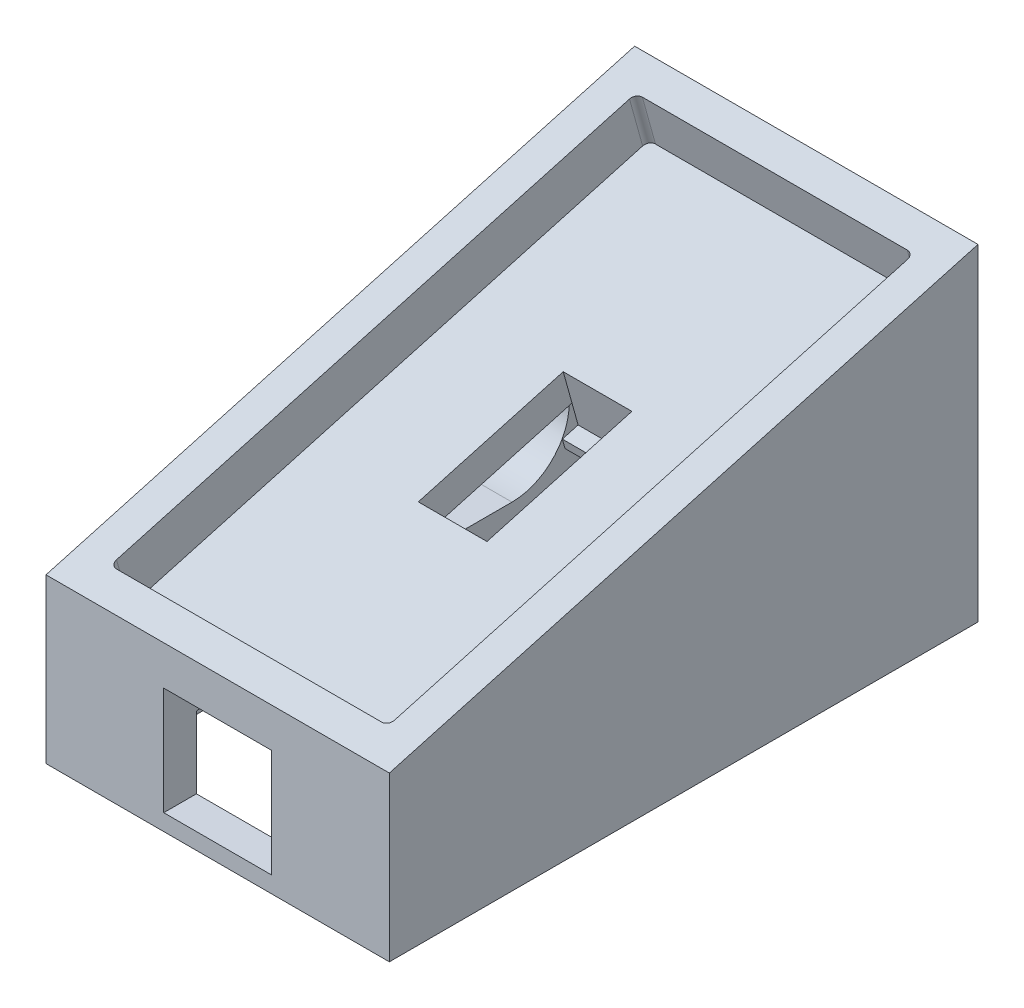
from build123d import *

# Parameters (mm, degrees)
SKETCH2_W            = 300
SKETCH2_H            = 180
BOSS_EXTRUDE1_DEPTH  = 50
CUT_EXTRUDE1_DEPTH   = 15
BOSS_EXTRUDE4_DEPTH  = 50
SKETCH10_W           = 105
SKETCH10_H           = 180
BOSS_EXTRUDE7_DEPTH  = 50
CUT_EXTRUDE3_DEPTH   = 105
CUT_EXTRUDE4_DEPTH   = 15
SKETCH14_W           = 70
SKETCH14_H           = 65
SKETCH14_W_2         = 95
BOSS_EXTRUDE8_DEPTH  = 35
CUT_EXTRUDE5_DEPTH   = 195
SHELL1_T             = -10
SKETCH16_W           = 21
SKETCH16_H           = 46
CUT_EXTRUDE7_DEPTH   = 10
SKETCH17_R           = 17.5
CUT_EXTRUDE15_DEPTH  = 10
CUT_EXTRUDE16_DEPTH  = 10
SKETCH22_W           = 40.092518347
SKETCH22_H           = 11.168807906
CUT_EXTRUDE17_DEPTH  = 33
SKETCH23_W           = 21
SKETCH23_H           = 10
BOSS_EXTRUDE9_DEPTH  = 3
SKETCH24_W           = 21
SKETCH24_H           = 3
BOSS_EXTRUDE10_DEPTH = 5
CUT_EXTRUDE18_DEPTH  = 10
SKETCH27_W           = 26
SKETCH27_H           = 30
CUT_EXTRUDE19_DEPTH  = 10


with BuildPart() as part:
    # Sketch2 → Boss-Extrude1 (new body)
    with BuildSketch(Plane(origin=(0, 0, 0), x_dir=(1, 0, 0), z_dir=(0, 1, 0))):
        with Locations((150, 90)):
            Rectangle(SKETCH2_W, SKETCH2_H)
    extrude(amount=BOSS_EXTRUDE1_DEPTH)

    # Sketch3 → Cut-Extrude1 (cut)
    with BuildSketch(Plane(origin=(0, 50, 0), x_dir=(1, 0, 0), z_dir=(0, 1, 0))):
        with BuildLine():
            Line((90, 12), (90, 73))
            ThreePointArc((90, 73), (90.585786438, 74.414213562), (92, 75))
            Line((92, 75), (183, 75))
            ThreePointArc((183, 75), (184.414213562, 74.414213562), (185, 73))
            Line((185, 73), (185, 12))
            ThreePointArc((185, 12), (184.414213562, 10.585786438), (183, 10))
            Line((183, 10), (92, 10))
            ThreePointArc((92, 10), (90.585786438, 10.585786438), (90, 12))
        make_face()
        with BuildLine():
            Line((12, 10), (78, 10))
            ThreePointArc((78, 10), (79.414213562, 10.585786438), (80, 12))
            Line((80, 12), (80, 73))
            ThreePointArc((80, 73), (79.414213562, 74.414213562), (78, 75))
            Line((78, 75), (12, 75))
            ThreePointArc((12, 75), (10.585786438, 74.414213562), (10, 73))
            Line((10, 73), (10, 12))
            ThreePointArc((10, 12), (10.585786438, 10.585786438), (12, 10))
        make_face()
    extrude(amount=-CUT_EXTRUDE1_DEPTH, mode=Mode.SUBTRACT)

    # Sketch6 → Boss-Extrude4 (add)
    with BuildSketch(Plane(origin=(0, 50, 0), x_dir=(1, 0, 0), z_dir=(0, 1, 0))):
        Polygon((0, 180), (185, 180), (195, 180), (195, 95), (185, 95), (0, 95), align=None)
        with BuildLine():
            Line((185, 168), (185, 107))
            ThreePointArc((185, 107), (184.414213562, 105.585786438), (183, 105))
            Line((183, 105), (92, 105))
            ThreePointArc((92, 105), (90.585786438, 105.585786438), (90, 107))
            Line((90, 107), (90, 168))
            ThreePointArc((90, 168), (90.585786438, 169.414213562), (92, 170))
            Line((92, 170), (183, 170))
            ThreePointArc((183, 170), (184.414213562, 169.414213562), (185, 168))
        make_face(mode=Mode.SUBTRACT)
        with BuildLine():
            Line((80, 107), (80, 168))
            ThreePointArc((80, 168), (79.414213562, 169.414213562), (78, 170))
            Line((78, 170), (12, 170))
            ThreePointArc((12, 170), (10.585786438, 169.414213562), (10, 168))
            Line((10, 168), (10, 107))
            ThreePointArc((10, 107), (10.585786438, 105.585786438), (12, 105))
            Line((12, 105), (78, 105))
            ThreePointArc((78, 105), (79.414213562, 105.585786438), (80, 107))
        make_face(mode=Mode.SUBTRACT)
    extrude(amount=BOSS_EXTRUDE4_DEPTH)

    # Sketch10 → Boss-Extrude7 (add)
    with BuildSketch(Plane(origin=(0, 50, 0), x_dir=(1, 0, 0), z_dir=(0, 1, 0))):
        with Locations((247.5, 90)):
            Rectangle(SKETCH10_W, SKETCH10_H)
    extrude(amount=BOSS_EXTRUDE7_DEPTH)

    # Sketch11 → Cut-Extrude3 (cut)
    with BuildSketch(Plane(origin=(300, 0, 0), x_dir=(0, 0, -1), z_dir=(1, 0, 0))):
        Polygon((0, 100), (180, 100), (0, 50), align=None)
    extrude(amount=-CUT_EXTRUDE3_DEPTH, mode=Mode.SUBTRACT)

    # Sketch13 → Cut-Extrude4 (cut)
    with BuildSketch(Plane(origin=(0, 46.418338109, 12.893982808), x_dir=(1, 0, 0), z_dir=(0, 0.9635179096299407, 0.2676438637860946))):
        with BuildLine():
            Line((288, 190.197610112), (207, 190.197610112))
            ThreePointArc((207, 190.197610112), (205.585786438, 189.611823674), (205, 188.197610112))
            Line((205, 188.197610112), (205, 25.382193189))
            ThreePointArc((205, 25.382193189), (205.585786438, 23.967979627), (207, 23.382193189))
            Line((207, 23.382193189), (288, 23.382193189))
            ThreePointArc((288, 23.382193189), (289.414213562, 23.967979627), (290, 25.382193189))
            Line((290, 25.382193189), (290, 188.197610112))
            ThreePointArc((290, 188.197610112), (289.414213562, 189.611823674), (288, 190.197610112))
        make_face()
    extrude(amount=-CUT_EXTRUDE4_DEPTH, mode=Mode.SUBTRACT)

    # Sketch14 → Boss-Extrude8 (add)
    with BuildSketch(Plane(origin=(0, 50, 0), x_dir=(1, 0, 0), z_dir=(0, 1, 0))):
        with Locations((45, 137.5)):
            Rectangle(SKETCH14_W, SKETCH14_H)
        with Locations((137.5, 137.5)):
            Rectangle(SKETCH14_W_2, SKETCH14_H)
    extrude(amount=BOSS_EXTRUDE8_DEPTH)

    # Sketch15 → Cut-Extrude5 (cut)
    with BuildSketch(Plane.ZY):
        Polygon((-180, 0), (0, 0), (0, 50), (-95, 50), (-95, 100), (-180, 100), align=None)
    extrude(amount=-CUT_EXTRUDE5_DEPTH, mode=Mode.SUBTRACT)

    # Shell1
    shell1_openings = [part.faces().sort_by_distance(p)[0] for p in [
        (247.5, 0, -90),
    ]]
    offset(amount=SHELL1_T, openings=shell1_openings, kind=Kind.INTERSECTION)

    # Sketch16 → Cut-Extrude7 (cut)
    with BuildSketch(Plane(origin=(0, 31.965569464, 8.879324851), x_dir=(1, 0, 0), z_dir=(0, 0.9635179096299407, 0.2676438637860946))):
        with Locations((247.5, 106.782193189)):
            Rectangle(SKETCH16_W, SKETCH16_H)
    extrude(amount=-CUT_EXTRUDE7_DEPTH, mode=Mode.SUBTRACT)

    # Sketch17 → Cut-Extrude15 (cut)
    with BuildSketch(Plane.ZY.offset(-195)):
        with Locations((-132.5, 25.5)):
            Circle(SKETCH17_R)
        with Locations((-47.5, 25.5)):
            Circle(SKETCH17_R)
    extrude(amount=-CUT_EXTRUDE15_DEPTH, mode=Mode.SUBTRACT)

    # Sketch20 → Cut-Extrude16 (cut)
    with BuildSketch(Plane.XY):
        Polygon((264, 38), (245, 38), (237, 38), (231, 38), (231, 34), (231, 25), (231, 5), (264, 5), align=None)
    extrude(amount=-CUT_EXTRUDE16_DEPTH, mode=Mode.SUBTRACT)

    # Sketch22 → Cut-Extrude17 (cut)
    with BuildSketch(Plane.ZY.offset(-264)):
        with Locations((-30.046259174, 32.415596047)):
            Rectangle(SKETCH22_W, SKETCH22_H)
    extrude(amount=CUT_EXTRUDE17_DEPTH, mode=Mode.SUBTRACT)

    # Sketch23 → Boss-Extrude9 (add)
    with BuildSketch(Plane(origin=(0, 34.735407636, -125.047467489), x_dir=(1, 0, 0), z_dir=(0, -0.2676438637860946, 0.9635179096299407))):
        with Locations((247.5, 18.175895481)):
            Rectangle(SKETCH23_W, SKETCH23_H)
    boss_extrude9 = extrude(amount=-BOSS_EXTRUDE9_DEPTH)

    # Sketch24 → Boss-Extrude10 (add)
    with BuildSketch(Plane(origin=(0, 34.735407636, -125.047467489), x_dir=(1, 0, 0), z_dir=(0, -0.2676438637860946, 0.9635179096299407))):
        with Locations((247.5, 14.675895481)):
            Rectangle(SKETCH24_W, SKETCH24_H)
    boss_extrude10 = extrude(amount=BOSS_EXTRUDE10_DEPTH)

    # Mirror1: Boss-Extrude9, Boss-Extrude10 across plane
    add(boss_extrude9.mirror(Plane(origin=(0, 28.579598769, -102.886555567), x_dir=(1, 0, 0), z_dir=(0, -0.2676438637860946, 0.9635179096299407))))
    add(boss_extrude10.mirror(Plane(origin=(0, 28.579598769, -102.886555567), x_dir=(1, 0, 0), z_dir=(0, -0.2676438637860946, 0.9635179096299407))))

    # Sketch26 → Cut-Extrude18 (cut)
    with BuildSketch(Plane.ZY.offset(-195)):
        with BuildLine():
            Line((-132.5, 43), (-47.5, 43))
            ThreePointArc((-47.5, 43), (-65, 25.5), (-47.5, 8))
            Line((-47.5, 8), (-132.5, 8))
            ThreePointArc((-132.5, 8), (-115, 25.5), (-132.5, 43))
        make_face()
    extrude(amount=-CUT_EXTRUDE18_DEPTH, mode=Mode.SUBTRACT)

    # Sketch27 → Cut-Extrude19 (cut)
    with BuildSketch(Plane(origin=(0, 0, -180), x_dir=(-1, 0, 0), z_dir=(0, 0, -1))):
        with Locations((-247.5, 45)):
            Rectangle(SKETCH27_W, SKETCH27_H)
    extrude(amount=-CUT_EXTRUDE19_DEPTH, mode=Mode.SUBTRACT)


solid = part.part
